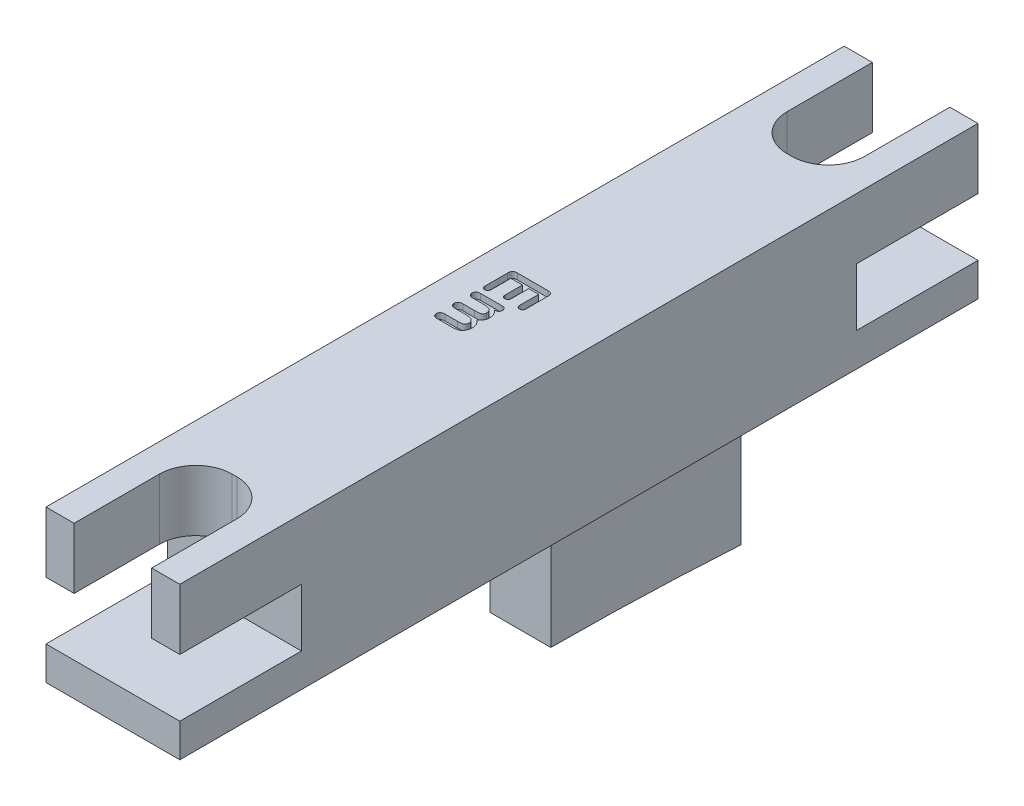
from build123d import *

# Parameters (mm, degrees)
SKETCH2_W            = 11.176
SKETCH2_H            = 66.675
BOSS_EXTRUDE1_DEPTH  = 12.7
SKETCH3_W            = 5.08
SKETCH3_H            = 6.35
SKETCH3_H_2          = 1.905
SKETCH3_H_3          = 1.27
BOSS_EXTRUDE2_DEPTH  = 12.7
CUT_EXTRUDE1_DEPTH   = 10.16
FILLET2_R            = 3.048
FILLET2_OF_MIRROR1_R = 3.048
CUT_EXTRUDE4_DEPTH   = 69.3893526
CUT_EXTRUDE5_DEPTH   = 0.508


with BuildPart() as part:
    # Sketch2 → Boss-Extrude1 (new body)
    with BuildSketch(Plane(origin=(0, 0, 0), x_dir=(1, 0, 0), z_dir=(0, 1, 0))):
        with Locations((5.588, 33.3375)):
            Rectangle(SKETCH2_W, SKETCH2_H)
    extrude(amount=BOSS_EXTRUDE1_DEPTH)

    # Sketch3 → Boss-Extrude2 (add)
    with BuildSketch(Plane.XZ):
        with Locations((5.334, -45.72)):
            Rectangle(SKETCH3_W, SKETCH3_H)
        with Locations((5.334, -41.5925)):
            Rectangle(SKETCH3_W, SKETCH3_H_2)
        with Locations((5.334, -37.465)):
            Rectangle(SKETCH3_W, SKETCH3_H)
        with Locations((5.334, -49.53)):
            Rectangle(SKETCH3_W, SKETCH3_H_3)
    extrude(amount=BOSS_EXTRUDE2_DEPTH)

    # Sketch4 → Cut-Extrude1 (cut)
    with BuildSketch(Plane.XY):
        Polygon((0, 7.62), (2.3495, 7.62), (2.3495, 12.7), (8.8265, 12.7), (8.8265, 7.62), (11.176, 7.62), (11.176, 2.794), (0, 2.794), align=None)
    cut_extrude1 = extrude(amount=-CUT_EXTRUDE1_DEPTH, mode=Mode.SUBTRACT)

    # Fillet2
    fillet2_edges = [part.edges().sort_by_distance(p)[0] for p in [
        (2.3495, 10.16, -10.16),
        (8.8265, 10.16, -10.16),
    ]]
    fillet(fillet2_edges, radius=FILLET2_R)

    # Mirror1: Cut-Extrude1 across plane
    add(cut_extrude1.mirror(Plane.XY.offset(-33.3375)), mode=Mode.SUBTRACT)

    # Fillet2 of Mirror1
    fillet2_of_mirror1_edges = [part.edges().sort_by_distance(p)[0] for p in [
        (2.3495, 10.16, -56.515),
        (8.8265, 10.16, -56.515),
    ]]
    fillet(fillet2_of_mirror1_edges, radius=FILLET2_OF_MIRROR1_R)

    # Sketch5 → Cut-Extrude4 (cut, through all)
    with BuildSketch(Plane.ZY.offset(-2.794)):
        with BuildLine():
            Line((-66.675, -12.7), (0, -12.7))
            ThreePointArc((0, -12.7), (-33.3375, -10.668), (-66.675, -12.7))
        make_face()
    extrude(amount=-CUT_EXTRUDE4_DEPTH, mode=Mode.SUBTRACT)

    # Sketch6 → Cut-Extrude5 (cut)
    with BuildSketch(Plane(origin=(0, 12.7, 0), x_dir=(1, 0, 0), z_dir=(0, 1, 0))):
        with BuildLine():
            Line((3.532117187, 31.45625), (2.700183594, 31.45625))
            add(Edge.make_bspline(
                [(2.700183594, 31.45625), (2.669338143, 31.457128008), (2.610981292, 31.458789122), (2.529373075, 31.475559551), (2.459866233, 31.504285235), (2.40308713, 31.544606319), (2.359267035, 31.59478237), (2.328049132, 31.652738509), (2.308862639, 31.718015491), (2.306813173, 31.763959318), (2.30575, 31.787792969)],
                knots=[0, 0, 0, 0, 1.266358617, 2.395837985, 3.40284976, 4.335732349, 5.231599188, 6.115692377, 7.022503512, 8, 8, 8, 8], degree=3))
            add(Edge.make_bspline(
                [(2.30575, 31.787792969), (2.306843764, 31.810936433), (2.308961405, 31.855744561), (2.32786295, 31.919370989), (2.359709039, 31.975613979), (2.403295371, 32.024814924), (2.459696335, 32.065313962), (2.52956354, 32.092966326), (2.61095026, 32.110033323), (2.669327413, 32.111647043), (2.700183594, 32.1125)],
                knots=[0, 0, 0, 0, 0.959247536, 1.857201947, 2.725516035, 3.623470446, 4.565917911, 5.579597411, 6.720657367, 8, 8, 8, 8], degree=3))
            Line((2.700183594, 32.1125), (3.697546875, 32.1125))
            add(Edge.make_bspline(
                [(3.697546875, 32.1125), (3.734692841, 32.112473581), (3.804674033, 32.112423808), (3.902897567, 32.116156505), (3.987936742, 32.120709486), (4.061156116, 32.126790119), (4.125305611, 32.138214235), (4.182493623, 32.156540013), (4.233720355, 32.182064077), (4.279240201, 32.214299666), (4.317351895, 32.255695714), (4.343651207, 32.30867662), (4.359232332, 32.371383271), (4.361039715, 32.416600526), (4.362, 32.440625)],
                knots=[0, 0, 0, 0, 1.575327959, 2.967841215, 4.168135644, 5.187490071, 6.082165716, 6.925686306, 7.72526632, 8.500469833, 9.28059761, 10.084546151, 10.982296201, 12, 12, 12, 12], degree=3))
            add(Edge.make_bspline(
                [(4.362, 32.440625), (4.361337257, 32.465265012), (4.360067681, 32.512466385), (4.350681588, 32.579969982), (4.334351273, 32.640941135), (4.311025404, 32.695602632), (4.281055951, 32.743820717), (4.243927836, 32.785100858), (4.200336163, 32.819504591), (4.150242947, 32.847563631), (4.09423843, 32.870540145), (4.032705548, 32.890253945), (3.965448176, 32.90638591), (3.892667297, 32.920024807), (3.814216997, 32.93101157), (3.729778995, 32.938141792), (3.639731589, 32.943226909), (3.57769796, 32.943572325), (3.545789062, 32.94375)],
                knots=[0, 0, 0, 0, 1.072726865, 2.054957592, 2.959985853, 3.813338004, 4.633692391, 5.420603725, 6.218633423, 7.040726042, 7.912341107, 8.850536995, 9.851629862, 10.921921998, 12.073946012, 13.299226168, 14.610774249, 16, 16, 16, 16], degree=3))
            Line((3.545789062, 32.94375), (2.700183594, 32.94375))
            add(Edge.make_bspline(
                [(2.700183594, 32.94375), (2.669552126, 32.944578724), (2.611843245, 32.946140019), (2.53116301, 32.963434428), (2.461847019, 32.991202119), (2.404609997, 33.030709611), (2.35988122, 33.079951923), (2.328958279, 33.137625095), (2.308694973, 33.201724309), (2.306751978, 33.247105379), (2.30575, 33.270507812)],
                knots=[0, 0, 0, 0, 1.266988192, 2.386972462, 3.398328206, 4.340886206, 5.243074081, 6.125898592, 7.033549998, 8, 8, 8, 8], degree=3))
            add(Edge.make_bspline(
                [(2.30575, 33.270507812), (2.306869895, 33.293643548), (2.30904872, 33.338655546), (2.327874651, 33.403083894), (2.360279366, 33.46002973), (2.403950618, 33.510485864), (2.460923361, 33.551241156), (2.530429987, 33.579575157), (2.611070777, 33.59781772), (2.668854711, 33.599243727), (2.6995, 33.6)],
                knots=[0, 0, 0, 0, 0.955872848, 1.859709514, 2.746023205, 3.64789137, 4.600178314, 5.613935963, 6.734568273, 8, 8, 8, 8], degree=3))
            Line((2.6995, 33.6), (4.488464844, 33.6))
            add(Edge.make_bspline(
                [(4.488464844, 33.6), (4.516101113, 33.598933688), (4.568409743, 33.596915422), (4.641992186, 33.582445351), (4.705150319, 33.556267781), (4.757201116, 33.519569021), (4.798405501, 33.47453902), (4.827733645, 33.421906438), (4.845397212, 33.362311927), (4.847134632, 33.320306842), (4.848035156, 33.298535156)],
                knots=[0, 0, 0, 0, 1.248966492, 2.363985007, 3.370183095, 4.316060979, 5.220194925, 6.105537004, 7.018079506, 8, 8, 8, 8], degree=3))
            add(Edge.make_bspline(
                [(4.848035156, 33.298535156), (4.847007203, 33.277471694), (4.845020526, 33.236763343), (4.828883377, 33.178124237), (4.800862515, 33.125600507), (4.763213555, 33.079031037), (4.716366036, 33.039754088), (4.659723336, 33.012567106), (4.595389416, 32.995652381), (4.549873684, 32.993890476), (4.5260625, 32.99296875)],
                knots=[0, 0, 0, 0, 1.012533589, 1.956875484, 2.898540199, 3.857472998, 4.823338609, 5.81384557, 6.856331155, 8, 8, 8, 8], degree=3))
            Line((4.5260625, 32.99296875), (4.466589844, 32.99296875))
            add(Edge.make_bspline(
                [(4.466589844, 32.99296875), (4.497495812, 32.96578811), (4.557384416, 32.913118327), (4.635097834, 32.825881303), (4.700658891, 32.73639066), (4.753248165, 32.642912835), (4.794098435, 32.545707494), (4.822838778, 32.443569166), (4.840421459, 32.336191824), (4.842295126, 32.262730813), (4.84325, 32.225292969)],
                knots=[0, 0, 0, 0, 1.114634638, 2.159903633, 3.159301083, 4.116094819, 5.060065846, 6.010198919, 6.985940124, 8, 8, 8, 8], degree=3))
            add(Edge.make_bspline(
                [(4.84325, 32.225292969), (4.842015287, 32.186951909), (4.839621087, 32.11260579), (4.822678178, 32.004996537), (4.793147187, 31.905729877), (4.752165042, 31.814587302), (4.698410827, 31.73186054), (4.633083819, 31.6570836), (4.555472005, 31.589706315), (4.496748079, 31.552568549), (4.466589844, 31.533496094)],
                knots=[0, 0, 0, 0, 1.110106727, 2.152578117, 3.144193379, 4.100926543, 5.036166651, 5.990211141, 6.967853688, 8, 8, 8, 8], degree=3))
            add(Edge.make_bspline(
                [(4.466589844, 31.533496094), (4.49685654, 31.50660606), (4.555694923, 31.4543319), (4.634823395, 31.370376771), (4.698768194, 31.281336851), (4.752734685, 31.190591017), (4.793394996, 31.095127585), (4.821953875, 30.994998841), (4.84061384, 30.890018079), (4.84236203, 30.818081969), (4.84325, 30.781542969)],
                knots=[0, 0, 0, 0, 1.115367949, 2.168272612, 3.170386143, 4.129817974, 5.072087581, 6.019862948, 6.994215459, 8, 8, 8, 8], degree=3))
            add(Edge.make_bspline(
                [(4.84325, 30.781542969), (4.842213999, 30.739534885), (4.840203535, 30.658014016), (4.820525513, 30.540304529), (4.789307986, 30.431344622), (4.745713481, 30.331782614), (4.690074936, 30.242745752), (4.623195482, 30.165302363), (4.545027956, 30.099561192), (4.485660387, 30.066705139), (4.455652344, 30.050097656)],
                knots=[0, 0, 0, 0, 1.152941859, 2.237398496, 3.267298389, 4.259246934, 5.212555278, 6.139849645, 7.059764894, 8, 8, 8, 8], degree=3))
            add(Edge.make_bspline(
                [(4.455652344, 30.050097656), (4.440736353, 30.043391531), (4.409238786, 30.029230444), (4.357139076, 30.013823767), (4.299635493, 29.998868221), (4.2357152, 29.988617554), (4.165957828, 29.979756294), (4.090060064, 29.972644364), (4.007921642, 29.969725781), (3.9511611, 29.969082926), (3.921765625, 29.96875)],
                knots=[0, 0, 0, 0, 0.72077696, 1.522039022, 2.392527629, 3.341243788, 4.375000762, 5.495464012, 6.702936508, 8, 8, 8, 8], degree=3))
            Line((3.921765625, 29.96875), (2.700183594, 29.96875))
            add(Edge.make_bspline(
                [(2.700183594, 29.96875), (2.669328116, 29.9696037), (2.610952293, 29.971218826), (2.52955675, 29.988276498), (2.459718071, 30.015959007), (2.403081234, 30.056457726), (2.35948889, 30.106484583), (2.327873643, 30.164004227), (2.308960357, 30.228944411), (2.306843213, 30.274644435), (2.30575, 30.298242188)],
                knots=[0, 0, 0, 0, 1.269718527, 2.402194636, 3.408248534, 4.343606252, 5.24185001, 6.120046476, 7.029263568, 8, 8, 8, 8], degree=3))
            add(Edge.make_bspline(
                [(2.30575, 30.298242188), (2.306776259, 30.321184649), (2.308775689, 30.365882762), (2.328915053, 30.429136002), (2.360254441, 30.486272293), (2.404715703, 30.535930611), (2.461557294, 30.576921946), (2.531040279, 30.605435443), (2.611854083, 30.622568421), (2.669555884, 30.624156865), (2.700183594, 30.625)],
                knots=[0, 0, 0, 0, 0.949369564, 1.849628418, 2.725779374, 3.636651653, 4.591842168, 5.608690816, 6.730709907, 8, 8, 8, 8], degree=3))
            Line((2.700183594, 30.625), (3.752234375, 30.625))
            add(Edge.make_bspline(
                [(3.752234375, 30.625), (3.784135081, 30.625383556), (3.844757955, 30.626112452), (3.930741708, 30.628255184), (4.006650041, 30.633954877), (4.073491597, 30.640793597), (4.133594097, 30.652648663), (4.187542718, 30.673182418), (4.236469252, 30.701320462), (4.28085843, 30.73582685), (4.318018747, 30.780244752), (4.34439817, 30.835325264), (4.358934714, 30.900206201), (4.36093959, 30.94644305), (4.362, 30.970898438)],
                knots=[0, 0, 0, 0, 1.423190491, 2.704576462, 3.835774627, 4.817962044, 5.701113927, 6.560068514, 7.379565508, 8.211388338, 9.056030056, 9.937952697, 10.909351167, 12, 12, 12, 12], degree=3))
            add(Edge.make_bspline(
                [(4.362, 30.970898438), (4.361037563, 30.991706547), (4.359123496, 31.033089144), (4.34490351, 31.094257962), (4.32118351, 31.153424465), (4.289274935, 31.21045405), (4.249545683, 31.263559186), (4.203753134, 31.311988323), (4.150547077, 31.353409992), (4.111204127, 31.375397776), (4.091296875, 31.386523437)],
                knots=[0, 0, 0, 0, 0.958273261, 1.905787515, 2.876746121, 3.88737006, 4.907925992, 5.925290398, 6.950211731, 8, 8, 8, 8], degree=3))
            add(Edge.make_bspline(
                [(4.091296875, 31.386523437), (4.077034715, 31.392258941), (4.046295879, 31.40462051), (3.99514292, 31.41842165), (3.936342051, 31.429681913), (3.870288605, 31.440206666), (3.796308489, 31.447191498), (3.714946336, 31.452906693), (3.626008091, 31.455131555), (3.564245976, 31.455867276), (3.532117187, 31.45625)],
                knots=[0, 0, 0, 0, 0.650550776, 1.402113892, 2.238582892, 3.185730303, 4.233290645, 5.384198073, 6.639254042, 8, 8, 8, 8], degree=3))
        make_face()
        with BuildLine():
            Line((5.19325, 34.418945312), (5.19325, 35.9625))
            Line((5.19325, 35.9625), (4.362, 35.9625))
            Line((4.362, 35.9625), (4.362, 34.541308594))
            add(Edge.make_bspline(
                [(4.362, 34.541308594), (4.36106664, 34.516646376), (4.35931467, 34.470353963), (4.346922285, 34.405553354), (4.324176667, 34.350750116), (4.292435917, 34.306165385), (4.252958065, 34.271924109), (4.207953428, 34.246753392), (4.156447348, 34.232038096), (4.120331739, 34.230427428), (4.101550781, 34.229589844)],
                knots=[0, 0, 0, 0, 1.285293232, 2.412569968, 3.418386025, 4.354403319, 5.23810445, 6.120527863, 7.022630715, 8, 8, 8, 8], degree=3))
            add(Edge.make_bspline(
                [(4.101550781, 34.229589844), (4.082749437, 34.230386162), (4.046594625, 34.231917475), (3.995376628, 34.247184911), (3.949067547, 34.270468115), (3.908708139, 34.304601131), (3.876216057, 34.349315164), (3.852656766, 34.404313536), (3.839515928, 34.46960597), (3.837873624, 34.516410782), (3.837, 34.541308594)],
                knots=[0, 0, 0, 0, 0.970712631, 1.866671451, 2.742370236, 3.637940775, 4.57451605, 5.578136324, 6.711690039, 8, 8, 8, 8], degree=3))
            Line((3.837, 34.541308594), (3.837, 35.9625))
            Line((3.837, 35.9625), (2.8745, 35.9625))
            Line((2.8745, 35.9625), (2.8745, 34.365625))
            add(Edge.make_bspline(
                [(2.8745, 34.365625), (2.8735501, 34.340286731), (2.871764391, 34.292653494), (2.859476637, 34.225480995), (2.836025391, 34.168668897), (2.804333649, 34.121515895), (2.764316564, 34.085404245), (2.718438968, 34.058523559), (2.665768886, 34.043480459), (2.628952669, 34.041339483), (2.609949219, 34.040234375)],
                knots=[0, 0, 0, 0, 1.282115211, 2.410239491, 3.433544999, 4.370413449, 5.259840111, 6.137762651, 7.038767785, 8, 8, 8, 8], degree=3))
            add(Edge.make_bspline(
                [(2.609949219, 34.040234375), (2.591387815, 34.04130204), (2.555657894, 34.043357251), (2.50447574, 34.058830307), (2.459565967, 34.085590419), (2.419713519, 34.121521306), (2.387780454, 34.168510842), (2.365617463, 34.225745925), (2.351908263, 34.292526909), (2.350335714, 34.34025854), (2.3495, 34.365625)],
                knots=[0, 0, 0, 0, 0.94634305, 1.821670557, 2.697075277, 3.594139625, 4.539053153, 5.56674892, 6.706875008, 8, 8, 8, 8], degree=3))
            Line((2.3495, 34.365625), (2.3495, 36.216796875))
            add(Edge.make_bspline(
                [(2.3495, 36.216796875), (2.350466239, 36.250170648), (2.352264303, 36.312275576), (2.370680376, 36.398270852), (2.400787961, 36.469951249), (2.445907595, 36.527362709), (2.506445006, 36.569083716), (2.580427477, 36.599358574), (2.66966782, 36.615384672), (2.733621192, 36.617576552), (2.767859375, 36.61875)],
                knots=[0, 0, 0, 0, 1.189944925, 2.214356848, 3.121275872, 3.943259729, 4.783004917, 5.7166381, 6.777575619, 8, 8, 8, 8], degree=3))
            Line((2.767859375, 36.61875), (5.299890625, 36.61875))
            add(Edge.make_bspline(
                [(5.299890625, 36.61875), (5.32337587, 36.618197938), (5.367971724, 36.617149635), (5.431783566, 36.610060607), (5.488566831, 36.596281007), (5.539331248, 36.578007659), (5.583573059, 36.55409369), (5.621745466, 36.524163537), (5.652476669, 36.487304712), (5.677662361, 36.444901006), (5.695624682, 36.396110527), (5.70961385, 36.341903477), (5.716592234, 36.281233065), (5.717681005, 36.238913293), (5.71825, 36.216796875)],
                knots=[0, 0, 0, 0, 1.25760687, 2.388054849, 3.429687073, 4.379296607, 5.269270079, 6.111463577, 6.959732887, 7.823909447, 8.739278143, 9.733531743, 10.815538057, 12, 12, 12, 12], degree=3))
            Line((5.71825, 36.216796875), (5.71825, 34.418945312))
            add(Edge.make_bspline(
                [(5.71825, 34.418945312), (5.717294138, 34.393380123), (5.715496341, 34.345296836), (5.703306163, 34.277659161), (5.6799504, 34.220727753), (5.648037158, 34.174132036), (5.608434178, 34.138946704), (5.563076035, 34.113331032), (5.511864768, 34.098014319), (5.475678458, 34.09642215), (5.457117187, 34.095605469)],
                knots=[0, 0, 0, 0, 1.303543407, 2.451718649, 3.482873774, 4.417375591, 5.305837532, 6.158811619, 7.05558772, 8, 8, 8, 8], degree=3))
            add(Edge.make_bspline(
                [(5.457117187, 34.095605469), (5.438090551, 34.096389194), (5.401210146, 34.097908334), (5.349038001, 34.113538139), (5.302569462, 34.13849449), (5.262855556, 34.174202728), (5.230711227, 34.220560462), (5.208417628, 34.277846336), (5.19593119, 34.345265971), (5.194180707, 34.393369409), (5.19325, 34.418945312)],
                knots=[0, 0, 0, 0, 0.961524532, 1.863777426, 2.731626687, 3.61454628, 4.543218546, 5.563575511, 6.704588277, 8, 8, 8, 8], degree=3))
        make_face()
    extrude(amount=-CUT_EXTRUDE5_DEPTH, mode=Mode.SUBTRACT)


solid = part.part
